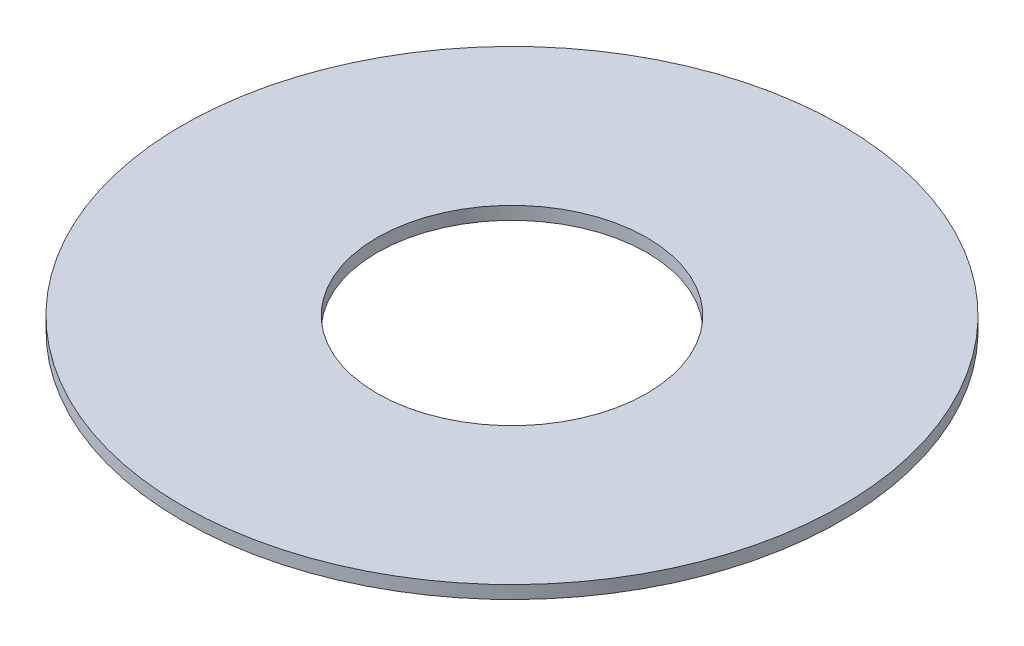
from build123d import *

# Parameters (mm, degrees)
SKETCH_1_R      = 12.7
SKETCH_1_R_2    = 5.2
EXTRUDE_1_DEPTH = 0.5


with BuildPart() as part:
    # Эскиз1 → Вытянуть1 (new body)
    with BuildSketch(Plane(origin=(0, 0, 0), x_dir=(1, 0, 0), z_dir=(0, 1, 0))):
        with Locations(Location((0, 0, 0), (0, 0, 270))):
            Circle(SKETCH_1_R)
        with Locations(Location((0, 0, 0), (0, 0, 270))):
            Circle(SKETCH_1_R_2, mode=Mode.SUBTRACT)
    extrude(amount=EXTRUDE_1_DEPTH)


solid = part.part
